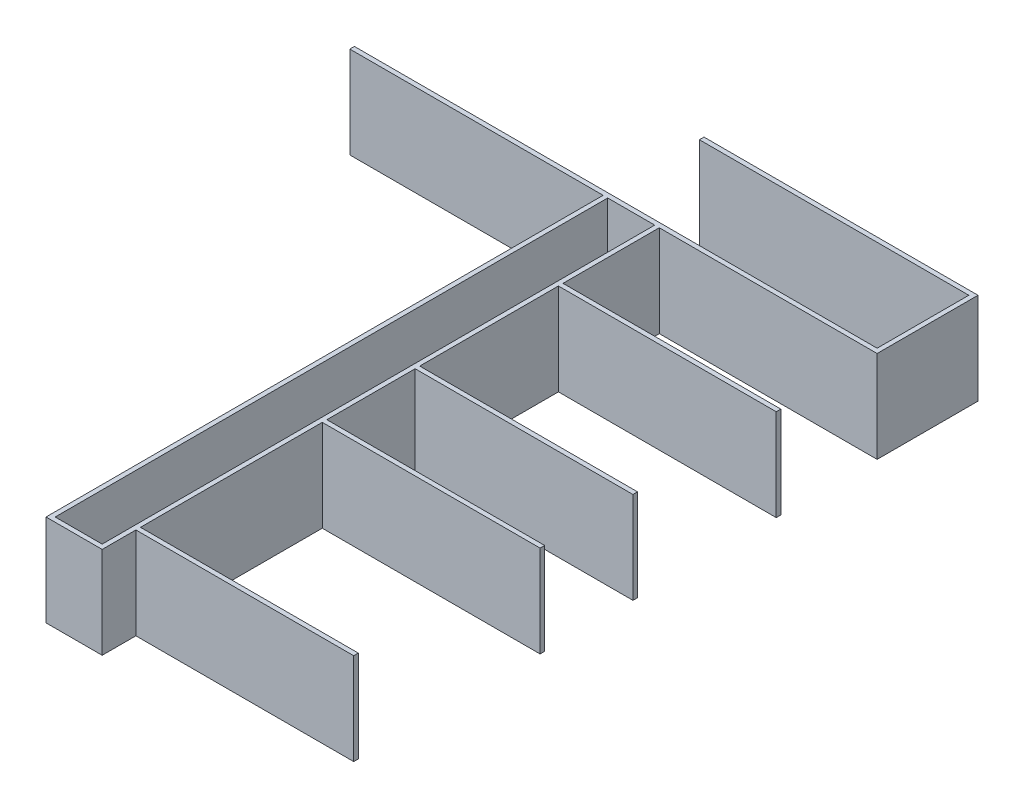
from build123d import *

# Parameters (mm, degrees)
BOSS_EXTRUDE1_DEPTH = 40
SKETCH1_4_W         = 20.5
SKETCH1_4_H         = 2
BOSS_EXTRUDE2_DEPTH = 40


with BuildPart() as part:
    # Sketch1 → Boss-Extrude1 (new body)
    with BuildSketch(Plane(origin=(0, 0, 0), x_dir=(1, 0, 0), z_dir=(0, 1, 0))):
        Polygon((95, 16.7), (0, 16.7), (0, 96), (95, 96), (95, 98), (0, 98), (0, 136.5), (95, 136.5), (95, 138.5), (0, 138.5), (0, 199), (95, 199), (95, 201), (0, 201), (0, 243), (95, 243), (95, 287), (-24.5, 287), (-24.5, 285), (93, 285), (93, 245), (-135, 245), (-135, 243), (-24.5, 243), (-24.5, 0), (-22.5, 0), (-22.5, 243), (-2, 243), (-2, 0), (0, 0), (0, 14.7), (95, 14.7), align=None)
    extrude(amount=BOSS_EXTRUDE1_DEPTH)

    # Sketch1<4> → Boss-Extrude2 (add)
    with BuildSketch(Plane(origin=(0, 0, 0), x_dir=(1, 0, 0), z_dir=(0, 1, 0))):
        with Locations((-12.25, 1)):
            Rectangle(SKETCH1_4_W, SKETCH1_4_H)
    extrude(amount=BOSS_EXTRUDE2_DEPTH)


solid = part.part
